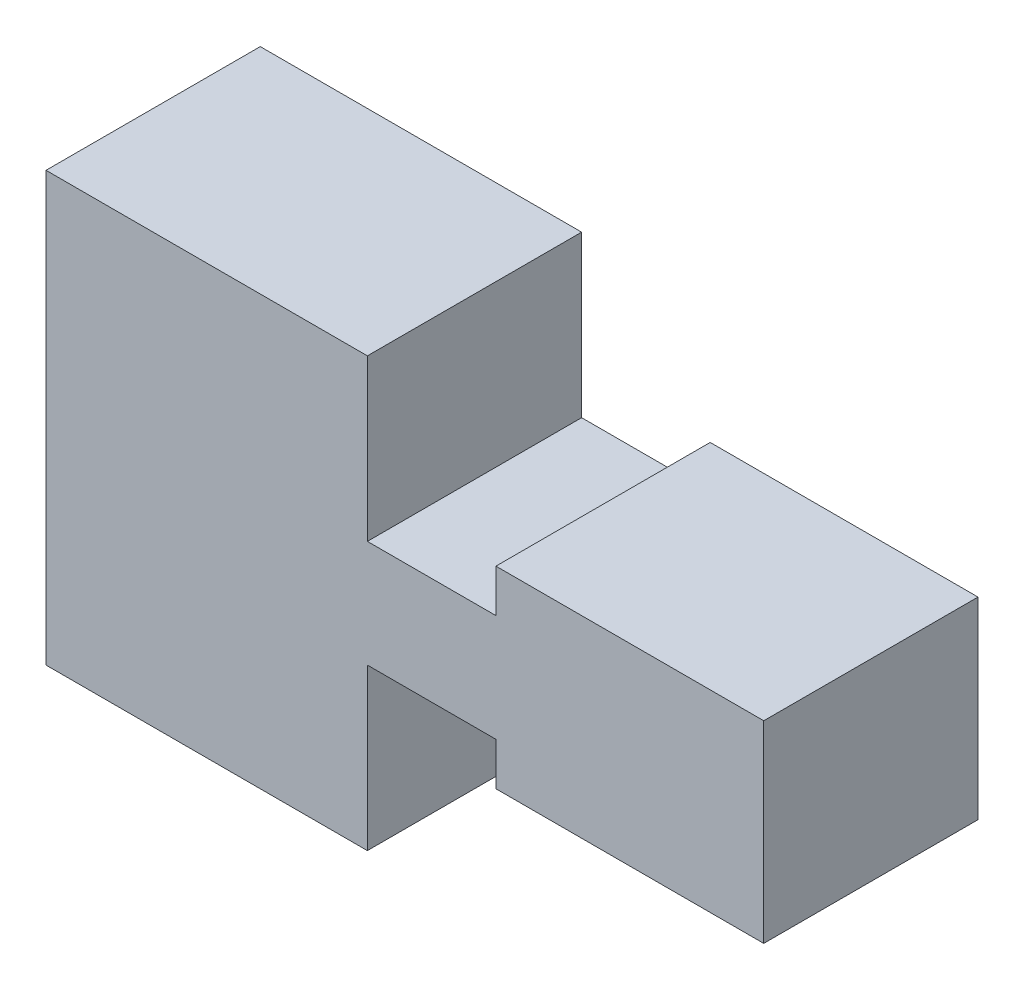
from build123d import *

# Parameters (mm, degrees)
SKETCH1_W           = 15
SKETCH1_H           = 20
SKETCH1_W_2         = 6
SKETCH1_H_2         = 5
BOSS_EXTRUDE1_DEPTH = 10


with BuildPart() as part:
    # Sketch1 → Boss-Extrude1 (new body)
    with BuildSketch(Plane.XY):
        Rectangle(SKETCH1_W, SKETCH1_H)
        with Locations((10.5, 0)):
            Rectangle(SKETCH1_W_2, SKETCH1_H_2)
        Polygon((13.5, 2.5), (13.5, -2.5), (13.5, -4.5), (26, -4.5), (26, 4.5), (13.5, 4.5), align=None)
    extrude(amount=BOSS_EXTRUDE1_DEPTH)


solid = part.part
